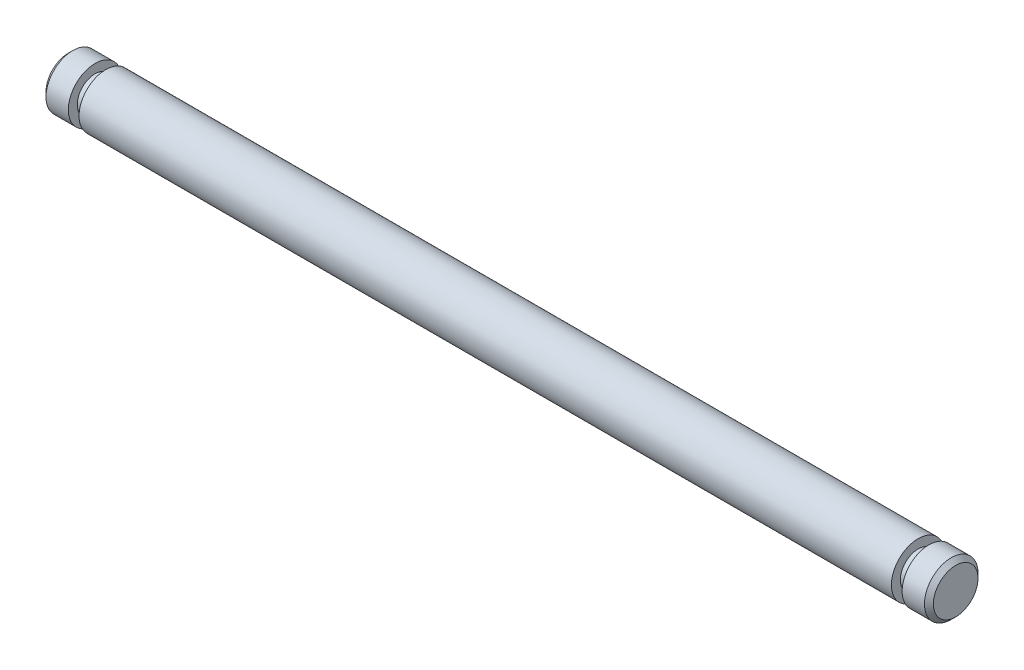
from build123d import *

# Parameters (mm, degrees)
CHAMFER1_SIZE = 0.25


with BuildPart() as part:
    # Sketch2 → Revolve1 (revolve)
    with BuildSketch(Plane.XY, mode=Mode.PRIVATE) as revolve1_sk:
        Polygon((22.75, 1.5), (-22.75, 1.5), (-22.75, 1), (-23.35, 1), (-23.35, 1.5), (-24.85, 1.5), (-24.85, 0), (24.85, 0), (24.85, 1.5), (23.35, 1.5), (23.35, 1), (22.75, 1), align=None)
    revolve(revolve1_sk.sketch.rotate(Axis((-61.756525867, 0, 0), (-1, 0, 0)), 90), axis=Axis((-61.756525867, 0, 0), (-1, 0, 0)))

    # Chamfer1
    chamfer1_edges = [part.edges().sort_by_distance(p)[0] for p in [
        (-24.85, 0, 1.5),
        (24.85, 0, 1.5),
    ]]
    chamfer(chamfer1_edges, length=CHAMFER1_SIZE)


solid = part.part
